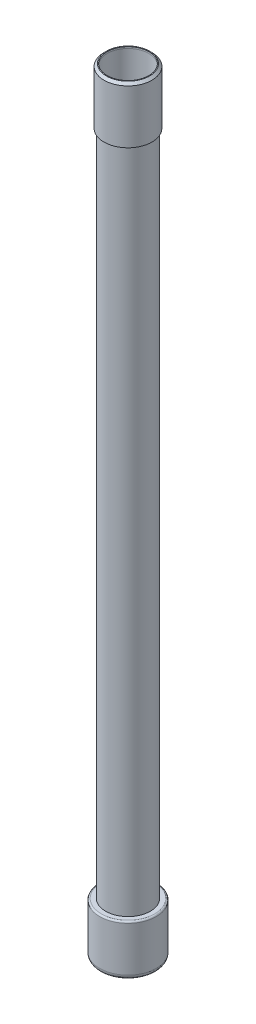
from build123d import *

# Parameters (mm, degrees)
SKETCH1_R      = 14
SKETCH1_R_2    = 13
EXTRUDE1_DEPTH = 240
FILLET1_R      = 3
FILLET2_R      = 1
CHAMFER1_SIZE  = 1.5


with BuildPart() as part:
    # Sketch1 → Extrude1 (new, symmetric)
    with BuildSketch(Plane(origin=(0, 0, 0), x_dir=(1, 0, 0), z_dir=(0, 1, 0))):
        with Locations(Location((0, 0, 0), (0, 0, 270))):
            Circle(SKETCH1_R)
        with Locations(Location((0, 0, 0), (0, 0, 270))):
            Circle(SKETCH1_R_2, mode=Mode.SUBTRACT)
    extrude(amount=EXTRUDE1_DEPTH, both=True)


with BuildPart() as body_2:
    # Sketch2 → Revolve1 (revolve)
    with BuildSketch(Plane.XY, mode=Mode.PRIVATE) as revolve1_sk:
        with BuildLine():
            Line((13, -211), (17.75, -211))
            Line((17.75, -211), (17.75, -242))
            ThreePointArc((17.75, -242), (9.097561486, -244.987616596), (0, -246))
            Line((0, -246), (0, -240))
            Line((0, -240), (13, -240))
            Line((13, -240), (13, -211))
        make_face()
    revolve(revolve1_sk.sketch.rotate(Axis((0, -191.854456481, 0), (0, -1, 0)), 90), axis=Axis((0, -191.854456481, 0), (0, -1, 0)))

    # Fillet1
    fillet1_edges = [body_2.edges().sort_by_distance(p)[0] for p in [
        (0, -242, -17.75),
    ]]
    fillet(fillet1_edges, radius=FILLET1_R)

    # Fillet2
    fillet2_edges = [body_2.edges().sort_by_distance(p)[0] for p in [
        (0, -211, -17.75),
    ]]
    fillet(fillet2_edges, radius=FILLET2_R)


with BuildPart() as body_3:
    # Sketch3 → Revolve2 (revolve)
    with BuildSketch(Plane.XY, mode=Mode.PRIVATE) as revolve2_sk:
        Polygon((15, 241), (15, 206), (14, 206), (14, 240), (13, 240), (13, 241), align=None)
    revolve(revolve2_sk.sketch.rotate(Axis((0, 250.648791431, 0), (0, -1, 0)), 90), axis=Axis((0, 250.648791431, 0), (0, -1, 0)))

    # Chamfer1
    chamfer1_edges = [body_3.edges().sort_by_distance(p)[0] for p in [
        (0, 241, -15),
    ]]
    chamfer(chamfer1_edges, length=CHAMFER1_SIZE)


solid = Compound([part.part, body_2.part, body_3.part])
